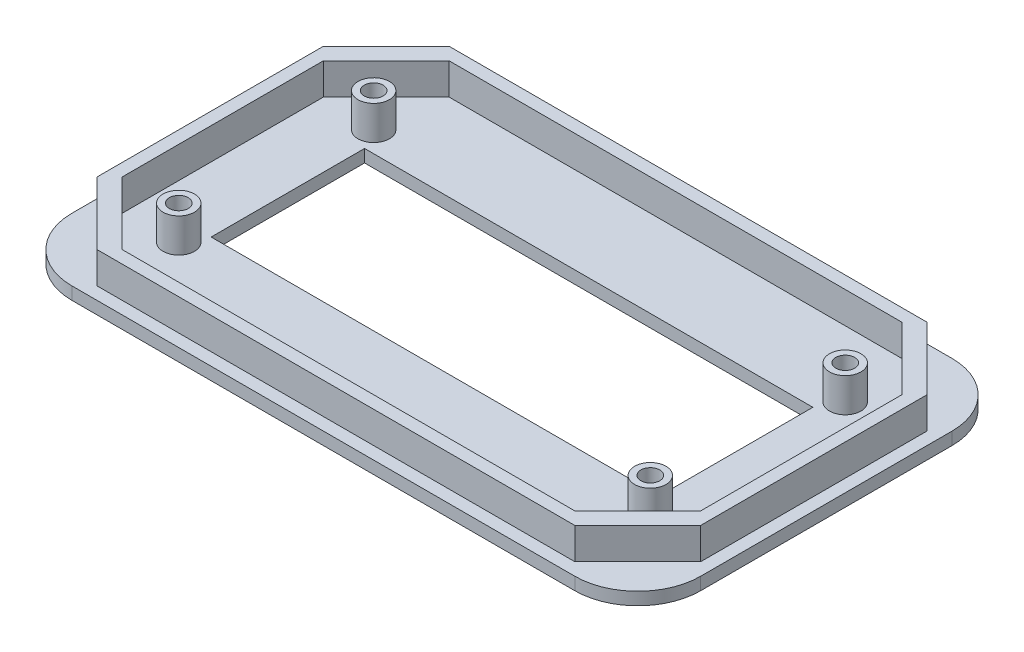
from build123d import *

# Parameters (mm, degrees)
Y_KSEKLIK_EKSTR_ZYON1_DEPTH = 2
Y_KSEKLIK_EKSTR_ZYON2_DEPTH = 5
IZIM3_W                     = 71.3
IZIM3_H                     = 24.4
KES_EKSTR_ZYON1_DEPTH       = 5
IZIM4_R                     = 2.5
IZIM4_R_2                   = 1.5
Y_KSEKLIK_EKSTR_ZYON3_DEPTH = 5.4


with BuildPart() as part:
    # Çizim1 → Yükseklik-Ekstrüzyon1 (new body)
    with BuildSketch(Plane(origin=(0, 0, 0), x_dir=(1, 0, 0), z_dir=(0, 1, 0))):
        with BuildLine():
            Line((10, 0), (90, 0))
            ThreePointArc((90, 0), (97.071067812, 2.928932188), (100, 10))
            Line((100, 10), (100, 50))
            ThreePointArc((100, 50), (97.071067812, 57.071067812), (90, 60))
            Line((90, 60), (10, 60))
            ThreePointArc((10, 60), (2.928932188, 57.071067812), (0, 50))
            Line((0, 50), (0, 10))
            ThreePointArc((0, 10), (2.928932188, 2.928932188), (10, 0))
        make_face()
    extrude(amount=Y_KSEKLIK_EKSTR_ZYON1_DEPTH)

    # Çizim2 → Yükseklik-Ekstrüzyon2 (add)
    with BuildSketch(Plane(origin=(0, 2, 0), x_dir=(1, 0, 0), z_dir=(0, 1, 0))):
        Polygon((12, 2), (88, 2), (98, 12), (98, 48), (88, 58), (12, 58), (2, 48), (2, 12), align=None)
        Polygon((4, 46), (4, 14), (14, 4), (86, 4), (96, 14), (96, 46), (86, 56), (14, 56), align=None, mode=Mode.SUBTRACT)
    extrude(amount=Y_KSEKLIK_EKSTR_ZYON2_DEPTH)

    # Çizim3 → Kes-Ekstrüzyon1 (cut)
    with BuildSketch(Plane(origin=(0, 2, 0), x_dir=(1, 0, 0), z_dir=(0, 1, 0))):
        with Locations((50, 30)):
            Rectangle(IZIM3_W, IZIM3_H)
    extrude(amount=-KES_EKSTR_ZYON1_DEPTH, mode=Mode.SUBTRACT)

    # Çizim4 → Yükseklik-Ekstrüzyon3 (add)
    # profile 1 of 4: a face of its own
    with BuildSketch(Plane(origin=(0, 2, 0), x_dir=(1, 0, 0), z_dir=(0, 1, 0))):
        with Locations(Location((12.5, 45.5, 0), (0, 0, 90))):
            Circle(IZIM4_R)
        with Locations(Location((12.5, 45.5, 0), (0, 0, 90))):
            Circle(IZIM4_R_2, mode=Mode.SUBTRACT)
    # profile 2 of 4: a face of its own
    with BuildSketch(Plane(origin=(0, 2, 0), x_dir=(1, 0, 0), z_dir=(0, 1, 0))):
        with Locations(Location((87.5, 45.5, 0), (0, 0, 90))):
            Circle(IZIM4_R)
        with Locations(Location((87.5, 45.5, 0), (0, 0, 90))):
            Circle(IZIM4_R_2, mode=Mode.SUBTRACT)
    # profile 3 of 4: a face of its own
    with BuildSketch(Plane(origin=(0, 2, 0), x_dir=(1, 0, 0), z_dir=(0, 1, 0))):
        with Locations(Location((87.5, 14.5, 0), (0, 0, 90))):
            Circle(IZIM4_R)
        with Locations(Location((87.5, 14.5, 0), (0, 0, 90))):
            Circle(IZIM4_R_2, mode=Mode.SUBTRACT)
    # profile 4 of 4: a face of its own
    with BuildSketch(Plane(origin=(0, 2, 0), x_dir=(1, 0, 0), z_dir=(0, 1, 0))):
        with Locations(Location((12.5, 14.5, 0), (0, 0, 90))):
            Circle(IZIM4_R)
        with Locations(Location((12.5, 14.5, 0), (0, 0, 90))):
            Circle(IZIM4_R_2, mode=Mode.SUBTRACT)
    extrude(amount=Y_KSEKLIK_EKSTR_ZYON3_DEPTH)


solid = part.part
